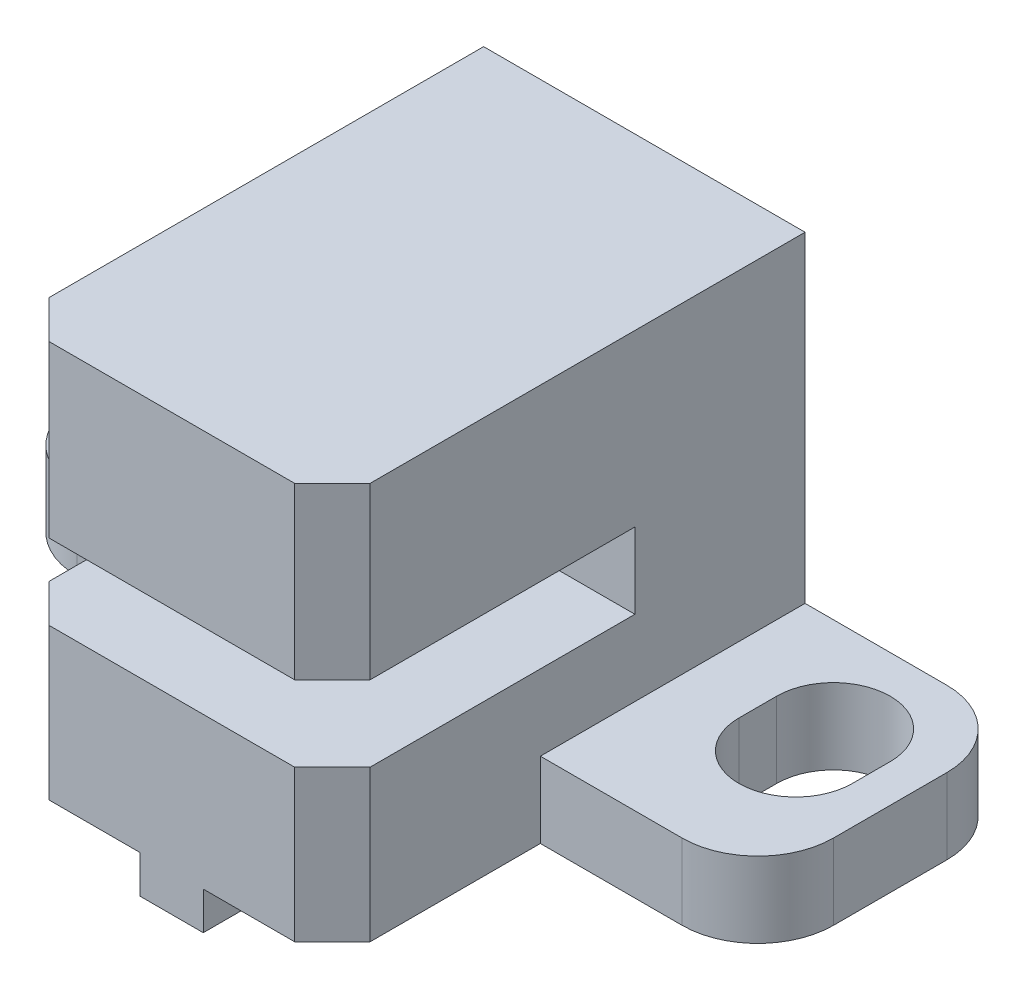
from build123d import *

# Parameters (mm, degrees)
SKETCH1_W           = 8.5
SKETCH1_H           = 10.5
BOSS_EXTRUDE1_DEPTH = 12.5
SKETCH2_W           = 8.5
SKETCH2_H           = 2
CUT_EXTRUDE1_DEPTH  = 8
BOSS_EXTRUDE2_DEPTH = 2
CHAMFER1_SIZE       = 1
SKETCH4_W           = 1.671920984
SKETCH4_H           = 12.5
BOSS_EXTRUDE3_DEPTH = 1


with BuildPart() as part:
    # Sketch1 → Boss-Extrude1 (new body)
    with BuildSketch(Plane.XY):
        Rectangle(SKETCH1_W, SKETCH1_H)
    extrude(amount=BOSS_EXTRUDE1_DEPTH)

    # Sketch2 → Cut-Extrude1 (cut)
    with BuildSketch(Plane.XY.offset(12.5)):
        with Locations((0, -0.25)):
            Rectangle(SKETCH2_W, SKETCH2_H)
    extrude(amount=-CUT_EXTRUDE1_DEPTH, mode=Mode.SUBTRACT)

    # Sketch3 → Boss-Extrude2 (add)
    # profile 1 of 2: a face of its own
    with BuildSketch(Plane.XZ.offset(5.25)):
        with BuildLine():
            Line((4.25, 0), (8, 0))
            ThreePointArc((8, 0), (9.414213562, 0.585786438), (10, 2))
            Line((10, 2), (10, 5))
            ThreePointArc((10, 5), (9.414213562, 6.414213562), (8, 7))
            Line((8, 7), (4.25, 7))
            Line((4.25, 7), (4.25, 0))
        make_face()
        with BuildLine():
            Line((6, 2.5), (6, 3.5))
            ThreePointArc((6, 3.5), (7.5, 5), (9, 3.5))
            Line((9, 3.5), (9, 2.5))
            ThreePointArc((9, 2.5), (7.5, 1), (6, 2.5))
        make_face(mode=Mode.SUBTRACT)
    # profile 2 of 2: a face of its own
    with BuildSketch(Plane.XZ.offset(5.25)):
        with BuildLine():
            Line((-10, 2), (-10, 5))
            ThreePointArc((-10, 5), (-9.414213562, 6.414213562), (-8, 7))
            Line((-8, 7), (-4.25, 7))
            Line((-4.25, 7), (-4.25, 0))
            Line((-4.25, 0), (-8, 0))
            ThreePointArc((-8, 0), (-9.414213562, 0.585786438), (-10, 2))
        make_face()
        with BuildLine():
            Line((-6, 2.5), (-6, 3.5))
            ThreePointArc((-6, 3.5), (-7.5, 5), (-9, 3.5))
            Line((-9, 3.5), (-9, 2.5))
            ThreePointArc((-9, 2.5), (-7.5, 1), (-6, 2.5))
        make_face(mode=Mode.SUBTRACT)
    extrude(amount=-BOSS_EXTRUDE2_DEPTH)

    # Chamfer1
    chamfer1_edges = [part.edges().sort_by_distance(p)[0] for p in [
        (-4.25, 3, 12.5),
        (4.25, 3, 12.5),
        (-4.25, -3.25, 12.5),
        (4.25, -3.25, 12.5),
    ]]
    chamfer(chamfer1_edges, length=CHAMFER1_SIZE)

    # Sketch4 → Boss-Extrude3 (add)
    with BuildSketch(Plane.XZ.offset(5.25)):
        with Locations((0, 6.25)):
            Rectangle(SKETCH4_W, SKETCH4_H)
    extrude(amount=BOSS_EXTRUDE3_DEPTH)


solid = part.part
